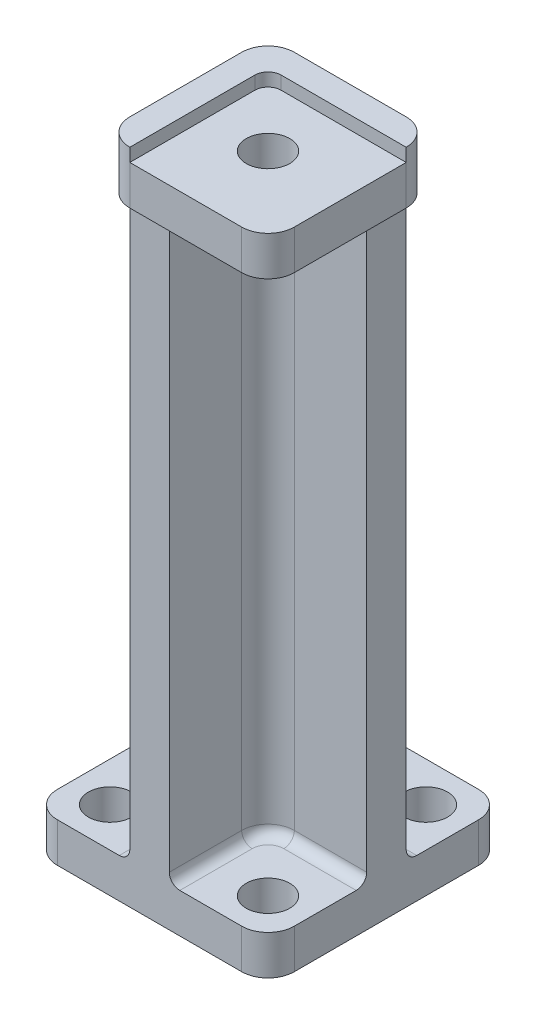
from build123d import *

# Parameters (mm, degrees)
SKETCH_1_W          = 18
SKETCH_1_H          = 18
EXTRUDE_1_DEPTH     = 3
SKETCH_2_R          = 1.65
CUT_EXTRUDE_1_DEPTH = 3
SKETCH_3_W          = 3
SKETCH_3_H          = 3
SKETCH_3_W_2        = 7.5
SKETCH_3_H_2        = 7.5
EXTRUDE_2_DEPTH     = 45
SKETCH_4_W          = 12.5
SKETCH_4_H          = 12.5
EXTRUDE_3_DEPTH     = 3
SKETCH_5_R          = 1.65
CUT_EXTRUDE_2_DEPTH = 3
CUT_EXTRUDE_3_DEPTH = 3
FILLET_1_R          = 2
FILLET_2_R          = 0.8
EXTRUDE_START       = 1
EXTRUDE_4_DEPTH     = 1
FILLET_3_R          = 1


with BuildPart() as part:
    # 草图1 → 凸台-拉伸1 (new body)
    with BuildSketch(Plane(origin=(0, 0, 0), x_dir=(1, 0, 0), z_dir=(0, 1, 0))):
        Rectangle(SKETCH_1_W, SKETCH_1_H)
    extrude(amount=EXTRUDE_1_DEPTH)

    # 草图2 → 切除-拉伸1 (cut)
    with BuildSketch(Plane(origin=(0, 3, 0), x_dir=(1, 0, 0), z_dir=(0, 1, 0))):
        with Locations(Location((-6, 6, 0), (0, 0, 270))):
            Circle(SKETCH_2_R)
        with Locations(Location((6, 6, 0), (0, 0, 270))):
            Circle(SKETCH_2_R)
        with Locations(Location((6, -6, 0), (0, 0, 270))):
            Circle(SKETCH_2_R)
        with Locations(Location((-6, -6, 0), (0, 0, 270))):
            Circle(SKETCH_2_R)
    extrude(amount=-CUT_EXTRUDE_1_DEPTH, mode=Mode.SUBTRACT)

    # 草图3 → 凸台-拉伸2 (add)
    with BuildSketch(Plane(origin=(0, 3, 0), x_dir=(1, 0, 0), z_dir=(0, 1, 0))):
        Rectangle(SKETCH_3_W, SKETCH_3_H)
        with Locations((5.25, 0)):
            Rectangle(SKETCH_3_W_2, SKETCH_3_H)
        with Locations((0, -5.25)):
            Rectangle(SKETCH_3_W, SKETCH_3_H_2)
    extrude(amount=EXTRUDE_2_DEPTH)

    # 草图4 → 凸台-拉伸3 (add)
    with BuildSketch(Plane(origin=(0, 48, 0), x_dir=(1, 0, 0), z_dir=(0, 1, 0))):
        with Locations((4.75, -4.75)):
            Rectangle(SKETCH_4_W, SKETCH_4_H)
    extrude(amount=EXTRUDE_3_DEPTH)

    # 草图5 → 切除-拉伸2 (cut)
    with BuildSketch(Plane(origin=(0, 51, 0), x_dir=(1, 0, 0), z_dir=(0, 1, 0))):
        with Locations(Location((5, -5, 0), (0, 0, 270))):
            Circle(SKETCH_5_R)
    extrude(amount=-CUT_EXTRUDE_2_DEPTH, mode=Mode.SUBTRACT)

    # 草图6 → 切除-拉伸3 (cut)
    with BuildSketch(Plane(origin=(0, 3, 0), x_dir=(1, 0, 0), z_dir=(0, 1, 0))):
        Polygon((-9, 9), (-9, 0.329900852), (-0.974802815, 9), align=None)
    extrude(amount=-CUT_EXTRUDE_3_DEPTH, mode=Mode.SUBTRACT)

    # 圆角1
    fillet_1_edges = [part.edges().sort_by_distance(p)[0] for p in [
        (-9, 1.5, 9),
        (9, 1.5, 9),
        (9, 1.5, -9),
        (-1.5, 49.5, 11),
        (11, 49.5, 11),
        (11, 49.5, -1.5),
        (1.5, 25.5, 1.5),
        (-1.5, 27, -1.5),
    ]]
    fillet(fillet_1_edges, radius=FILLET_1_R)

    # 圆角2
    fillet_2_edges = [part.edges().sort_by_distance(p)[0] for p in [
        (2.085786438, 3, 2.085786438),
        (-0.914213562, 3, -0.914213562),
        (1.5, 3, 6.25),
        (-1.5, 3, 4.75),
        (6.25, 3, 1.5),
        (4.75, 3, -1.5),
    ]]
    fillet(fillet_2_edges, radius=FILLET_2_R)

    # 草图7 → 凸台-拉伸4 (add)
    with BuildSketch(Plane(origin=(0, 51, 0), x_dir=(1, 0, 0), z_dir=(0, 1, 0)).offset(EXTRUDE_START)):
        with BuildLine():
            Line((0.5, -11), (0.5, -0.5))
            Line((0.5, -0.5), (11, -0.5))
            ThreePointArc((11, -0.5), (10.414213562, 0.914213562), (9, 1.5))
            Line((9, 1.5), (0.5, 1.5))
            ThreePointArc((0.5, 1.5), (-0.914213562, 0.914213562), (-1.5, -0.5))
            Line((-1.5, -0.5), (-1.5, -9))
            ThreePointArc((-1.5, -9), (-0.914213562, -10.414213562), (0.5, -11))
        make_face()
    extrude(amount=-EXTRUDE_4_DEPTH)

    # 圆角3
    fillet_3_edges = [part.edges().sort_by_distance(p)[0] for p in [
        (0.5, 51.5, 0.5),
    ]]
    fillet(fillet_3_edges, radius=FILLET_3_R)


solid = part.part
